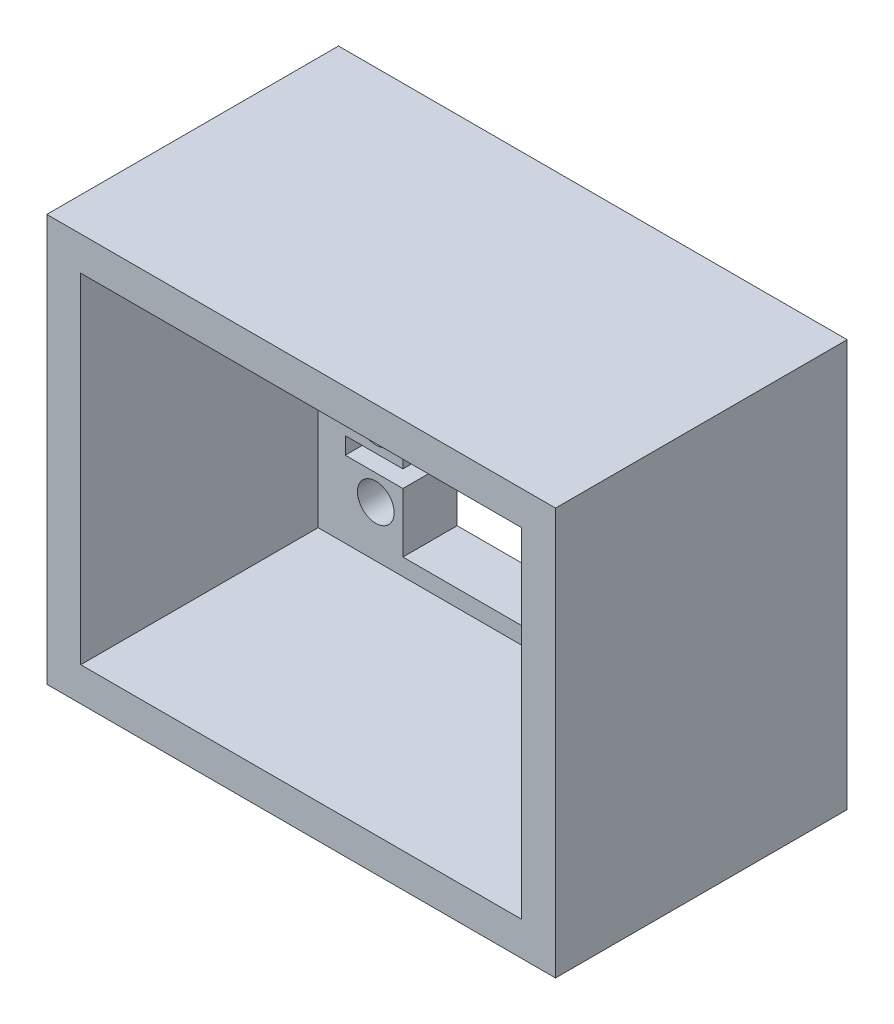
from build123d import *

# Parameters (mm, degrees)
ESQUISSE1_W               = 75
ESQUISSE1_H               = 60
BOSS_EXTRU_1_DEPTH        = 8
ESQUISSE2_W               = 40
ESQUISSE2_H               = 20
ENL_V_MAT_EXTRU_1_DEPTH   = 8
ESQUISSE3_W               = 8.5
ESQUISSE3_H               = 2.5
ENL_V_MAT_EXTRU_2_DEPTH   = 8
ESQUISSE4_R               = 2.7
ENL_V_MAT_EXTRU_3_DEPTH   = 49.685213361
SYM_TRIE4_COPY_1_SKETCH_W = 8.5
SYM_TRIE4_COPY_1_SKETCH_H = 2.5
SYM_TRIE4_COPY_1_DEPTH    = 8
SYM_TRIE4_COPY_2_SKETCH_R = 2.7
SYM_TRIE4_COPY_2_DEPTH    = 49.685213361
ESQUISSE6_W               = 75
ESQUISSE6_H               = 60
BOSS_EXTRU_2_DEPTH        = 35
ESQUISSE7_W               = 65
ESQUISSE7_H               = 50
ENL_V_MAT_EXTRU_4_DEPTH   = 35


with BuildPart() as part:
    # Esquisse1 → Boss.-Extru.1 (new body)
    with BuildSketch(Plane.XY):
        Rectangle(ESQUISSE1_W, ESQUISSE1_H)
    extrude(amount=-BOSS_EXTRU_1_DEPTH)

    # Esquisse2 → Enlèv. mat.-Extru.1 (cut)
    with BuildSketch(Plane.XY):
        with Locations((0, 12.5)):
            Rectangle(ESQUISSE2_W, ESQUISSE2_H)
    enl_v_mat_extru_1 = extrude(amount=-ENL_V_MAT_EXTRU_1_DEPTH, mode=Mode.SUBTRACT)

    # Esquisse3 → Enlèv. mat.-Extru.2 (cut)
    with BuildSketch(Plane.XY):
        with Locations((-24.25, 12.5)):
            Rectangle(ESQUISSE3_W, ESQUISSE3_H)
    enl_v_mat_extru_2 = extrude(amount=-ENL_V_MAT_EXTRU_2_DEPTH, mode=Mode.SUBTRACT)

    # Esquisse4 → Enlèv. mat.-Extru.3 (cut, through all)
    with BuildSketch(Plane.XY):
        with Locations((-24, 17.5)):
            Circle(ESQUISSE4_R)
        with Locations((-24, 7.5)):
            Circle(ESQUISSE4_R)
    enl_v_mat_extru_3 = extrude(amount=-ENL_V_MAT_EXTRU_3_DEPTH, mode=Mode.SUBTRACT)

    # Symétrie2: Enlèv. mat.-Extru.2, Enlèv. mat.-Extru.3 across plane
    add(enl_v_mat_extru_2.mirror(Plane(origin=(0, 0, 0), x_dir=(0, 0, 1), z_dir=(1, 0, 0))), mode=Mode.SUBTRACT)
    add(enl_v_mat_extru_3.mirror(Plane(origin=(0, 0, 0), x_dir=(0, 0, 1), z_dir=(1, 0, 0))), mode=Mode.SUBTRACT)

    # Symétrie4: Enlèv. mat.-Extru.1, Enlèv. mat.-Extru.2, Enlèv. mat.-Extru.3 across plane
    add(enl_v_mat_extru_1.mirror(Plane.ZX), mode=Mode.SUBTRACT)
    add(enl_v_mat_extru_2.mirror(Plane.ZX), mode=Mode.SUBTRACT)
    add(enl_v_mat_extru_3.mirror(Plane.ZX), mode=Mode.SUBTRACT)

    # Symétrie4 copy 1 sketch → Symétrie4 copy 1 (cut)
    with BuildSketch(Plane(origin=(0, 0, 0), x_dir=(-1, 0, 0), z_dir=(0, 0, 1))):
        with Locations((-24.25, 12.5)):
            Rectangle(SYM_TRIE4_COPY_1_SKETCH_W, SYM_TRIE4_COPY_1_SKETCH_H)
    extrude(amount=-SYM_TRIE4_COPY_1_DEPTH, mode=Mode.SUBTRACT)

    # Symétrie4 copy 2 sketch → Symétrie4 copy 2 (cut, through all)
    with BuildSketch(Plane(origin=(0, 0, 0), x_dir=(-1, 0, 0), z_dir=(0, 0, 1))):
        with Locations((-24, 17.5)):
            Circle(SYM_TRIE4_COPY_2_SKETCH_R)
        with Locations((-24, 7.5)):
            Circle(SYM_TRIE4_COPY_2_SKETCH_R)
    extrude(amount=-SYM_TRIE4_COPY_2_DEPTH, mode=Mode.SUBTRACT)

    # Esquisse6 → Boss.-Extru.2 (add)
    with BuildSketch(Plane.XY):
        Rectangle(ESQUISSE6_W, ESQUISSE6_H)
    extrude(amount=BOSS_EXTRU_2_DEPTH)

    # Esquisse7 → Enlèv. mat.-Extru.4 (cut)
    with BuildSketch(Plane.XY.offset(35)):
        Rectangle(ESQUISSE7_W, ESQUISSE7_H)
    extrude(amount=-ENL_V_MAT_EXTRU_4_DEPTH, mode=Mode.SUBTRACT)


solid = part.part
